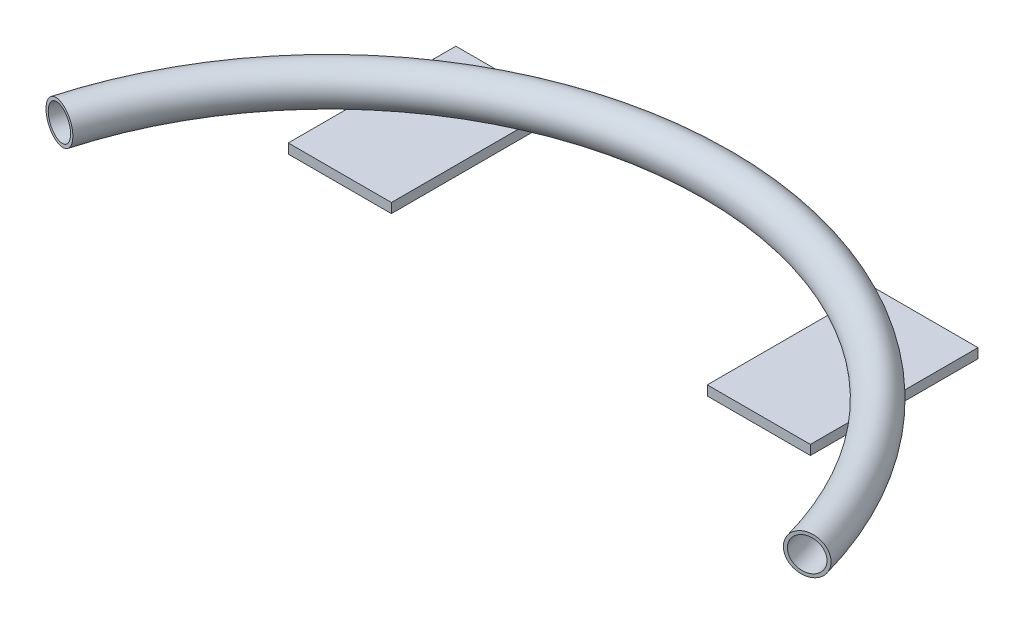
from build123d import *

# Parameters (mm, degrees)
SKETCH3_R        = 19.05
SKETCH3_R_2      = 15.875
SKETCH4_W        = 101.6
SKETCH4_H        = 165.1
EXTRUDE1_DEPTH   = 9.525
EXTRUDE1_2_DEPTH = 9.525


with BuildPart() as part:
    # Sweep1: sweep along a path in Sketch1
    with BuildLine(Plane(origin=(0, 0, 0), x_dir=(1, 0, 0), z_dir=(0, 1, 0))) as sweep1_path:
        ThreePointArc((-368.3, 0), (0, 279.4), (368.3, 0))
    # Sketch3 → Sweep1 (sweep)
    with BuildSketch(Plane(origin=(368.3, 0, 0), x_dir=(0.9630188679245283, 0, -0.26943396226415106), z_dir=(0.26943396226415106, 0, 0.9630188679245284))):
        Circle(SKETCH3_R)
        Circle(SKETCH3_R_2, mode=Mode.SUBTRACT)
    sweep(path=sweep1_path.line)


with BuildPart() as body_2:
    # Sketch4 → Extrude1 (new body)
    with BuildSketch(Plane(origin=(0, -19.05, 0), x_dir=(-1, 0, 0), z_dir=(0, 1, 0))):
        with Locations((-206.375, -196.85)):
            Rectangle(SKETCH4_W, SKETCH4_H)
    extrude(amount=-EXTRUDE1_DEPTH)


with BuildPart() as body_3:
    # Sketch4 → Extrude1 2 (new body)
    with BuildSketch(Plane(origin=(0, -19.05, 0), x_dir=(-1, 0, 0), z_dir=(0, 1, 0))):
        with Locations((206.375, -196.85)):
            Rectangle(SKETCH4_W, SKETCH4_H)
    extrude(amount=-EXTRUDE1_2_DEPTH)


solid = Compound([part.part, body_2.part, body_3.part])
